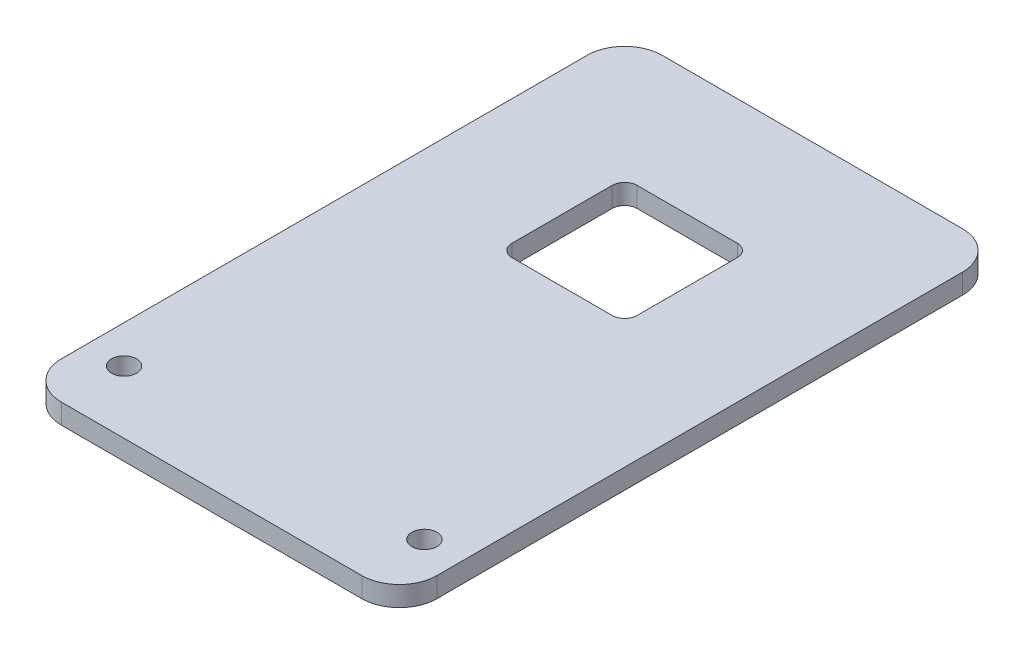
from build123d import *

# Parameters (mm, degrees)
SKETCH_1_W      = 30
SKETCH_1_H      = 48
SKETCH_1_R      = 1
SKETCH_1_W_2    = 10
SKETCH_1_H_2    = 10
EXTRUDE_1_DEPTH = 1.6
FILLET_1_R      = 3
FILLET_2_R      = 1


with BuildPart() as part:
    # 草图1 → 凸台-拉伸1 (new body)
    with BuildSketch(Plane(origin=(0, 0, 0), x_dir=(1, 0, 0), z_dir=(0, 1, 0))):
        Rectangle(SKETCH_1_W, SKETCH_1_H)
        with Locations(Location((-12, -19, 0), (0, 0, 270))):
            Circle(SKETCH_1_R, mode=Mode.SUBTRACT)
        with Locations(Location((12, -19, 0), (0, 0, 270))):
            Circle(SKETCH_1_R, mode=Mode.SUBTRACT)
        with Locations((0, 9)):
            Rectangle(SKETCH_1_W_2, SKETCH_1_H_2, mode=Mode.SUBTRACT)
    extrude(amount=EXTRUDE_1_DEPTH)

    # 圆角1
    fillet_1_edges = [part.edges().sort_by_distance(p)[0] for p in [
        (15, 0.8, 24),
        (-15, 0.8, 24),
        (-15, 0.8, -24),
        (15, 0.8, -24),
    ]]
    fillet(fillet_1_edges, radius=FILLET_1_R)

    # 圆角2
    fillet_2_edges = [part.edges().sort_by_distance(p)[0] for p in [
        (5, 0.8, -4),
        (5, 0.8, -14),
        (-5, 0.8, -14),
        (-5, 0.8, -4),
    ]]
    fillet(fillet_2_edges, radius=FILLET_2_R)


solid = part.part
